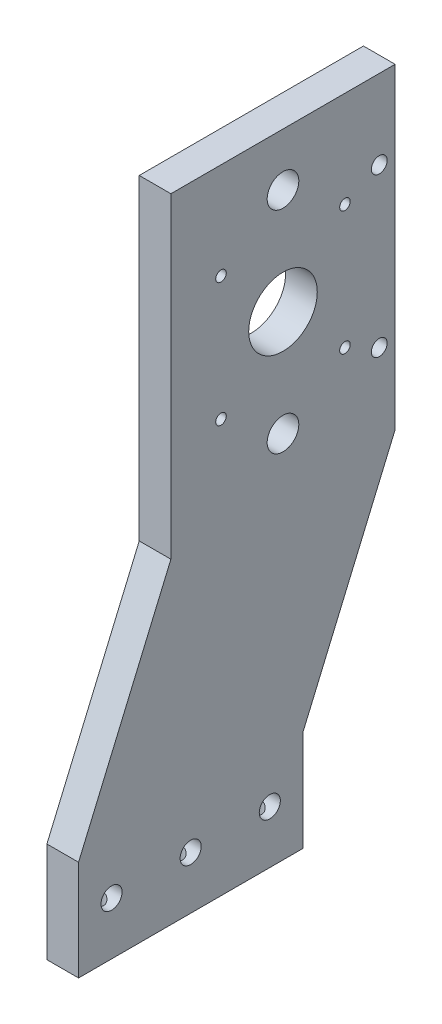
from build123d import *

# Parameters (mm, degrees)
BOSS_EXTRUDE1_DEPTH = 12
CUT_EXTRUDE1_REACH  = 270.596
SKETCH2_R           = 4
CUT_EXTRUDE2_REACH  = 270.596
SKETCH3_R           = 3
CUT_EXTRUDE3_REACH  = 270.596
SKETCH4_R           = 13
SKETCH4_R_2         = 6
SKETCH4_R_3         = 2
CUT_EXTRUDE4_REACH  = 270.596
SKETCH5_R           = 3


with BuildPart() as part:
    # Sketch1 → Boss-Extrude1 (new body)
    with BuildSketch(Plane(origin=(0, 0, 0), x_dir=(0, 0, -1), z_dir=(1, 0, 0))):
        Polygon((120, 240), (35, 240), (35, 120), (0, 38), (0, 0), (85, 0), (85, 38), (120, 120), align=None)
    extrude(amount=BOSS_EXTRUDE1_DEPTH)

    # Sketch2 → Cut-Extrude1 (cut, up to next)
    with BuildSketch(Plane.ZY, mode=Mode.PRIVATE) as cut_extrude1_sk1:
        with Locations((-42.5, 20)):
            Circle(SKETCH2_R)
    cut_extrude1_tool1 = extrude(cut_extrude1_sk1.sketch, amount=-CUT_EXTRUDE1_REACH, mode=Mode.PRIVATE) & part.part
    # Sketch2 → Cut-Extrude1 (cut, up to next)
    with BuildSketch(Plane.ZY, mode=Mode.PRIVATE) as cut_extrude1_sk2:
        with Locations((-72.5, 20)):
            Circle(SKETCH2_R)
    cut_extrude1_tool2 = extrude(cut_extrude1_sk2.sketch, amount=-CUT_EXTRUDE1_REACH, mode=Mode.PRIVATE) & part.part
    # Sketch2 → Cut-Extrude1 (cut, up to next)
    with BuildSketch(Plane.ZY, mode=Mode.PRIVATE) as cut_extrude1_sk3:
        with Locations((-12.5, 20)):
            Circle(SKETCH2_R)
    cut_extrude1_tool3 = extrude(cut_extrude1_sk3.sketch, amount=-CUT_EXTRUDE1_REACH, mode=Mode.PRIVATE) & part.part
    add(cut_extrude1_tool1.solids().sort_by_distance((0, 20, -42.5))[0], mode=Mode.SUBTRACT)
    add(cut_extrude1_tool2.solids().sort_by_distance((0, 20, -72.5))[0], mode=Mode.SUBTRACT)
    add(cut_extrude1_tool3.solids().sort_by_distance((0, 20, -12.5))[0], mode=Mode.SUBTRACT)

    # Sketch3 → Cut-Extrude2 (cut, up to next)
    with BuildSketch(Plane.XZ, mode=Mode.PRIVATE) as cut_extrude2_sk1:
        with Locations(Location((6, -42.5, 0), (0, 0, 270))):
            Circle(SKETCH3_R)
    cut_extrude2_tool1 = extrude(cut_extrude2_sk1.sketch, amount=-CUT_EXTRUDE2_REACH, mode=Mode.PRIVATE) & part.part
    # Sketch3 → Cut-Extrude2 (cut, up to next)
    with BuildSketch(Plane.XZ, mode=Mode.PRIVATE) as cut_extrude2_sk2:
        with Locations(Location((6, -72.5, 0), (0, 0, 270))):
            Circle(SKETCH3_R)
    cut_extrude2_tool2 = extrude(cut_extrude2_sk2.sketch, amount=-CUT_EXTRUDE2_REACH, mode=Mode.PRIVATE) & part.part
    # Sketch3 → Cut-Extrude2 (cut, up to next)
    with BuildSketch(Plane.XZ, mode=Mode.PRIVATE) as cut_extrude2_sk3:
        with Locations(Location((6, -12.5, 0), (0, 0, 270))):
            Circle(SKETCH3_R)
    cut_extrude2_tool3 = extrude(cut_extrude2_sk3.sketch, amount=-CUT_EXTRUDE2_REACH, mode=Mode.PRIVATE) & part.part
    add(cut_extrude2_tool1.solids().sort_by_distance((6, 0, -42.5))[0], mode=Mode.SUBTRACT)
    add(cut_extrude2_tool2.solids().sort_by_distance((6, 0, -72.5))[0], mode=Mode.SUBTRACT)
    add(cut_extrude2_tool3.solids().sort_by_distance((6, 0, -12.5))[0], mode=Mode.SUBTRACT)

    # Sketch4 → Cut-Extrude3 (cut, up to next)
    with BuildSketch(Plane.ZY, mode=Mode.PRIVATE) as cut_extrude3_sk1:
        with Locations((-77.5, 180)):
            Circle(SKETCH4_R)
    cut_extrude3_tool1 = extrude(cut_extrude3_sk1.sketch, amount=-CUT_EXTRUDE3_REACH, mode=Mode.PRIVATE) & part.part
    # Sketch4 → Cut-Extrude3 (cut, up to next)
    with BuildSketch(Plane.ZY, mode=Mode.PRIVATE) as cut_extrude3_sk2:
        with Locations((-77.5, 220)):
            Circle(SKETCH4_R_2)
    cut_extrude3_tool2 = extrude(cut_extrude3_sk2.sketch, amount=-CUT_EXTRUDE3_REACH, mode=Mode.PRIVATE) & part.part
    # Sketch4 → Cut-Extrude3 (cut, up to next)
    with BuildSketch(Plane.ZY, mode=Mode.PRIVATE) as cut_extrude3_sk3:
        with Locations((-77.5, 140)):
            Circle(SKETCH4_R_2)
    cut_extrude3_tool3 = extrude(cut_extrude3_sk3.sketch, amount=-CUT_EXTRUDE3_REACH, mode=Mode.PRIVATE) & part.part
    # Sketch4 → Cut-Extrude3 (cut, up to next)
    with BuildSketch(Plane.ZY, mode=Mode.PRIVATE) as cut_extrude3_sk4:
        with Locations((-101, 203.5)):
            Circle(SKETCH4_R_3)
    cut_extrude3_tool4 = extrude(cut_extrude3_sk4.sketch, amount=-CUT_EXTRUDE3_REACH, mode=Mode.PRIVATE) & part.part
    # Sketch4 → Cut-Extrude3 (cut, up to next)
    with BuildSketch(Plane.ZY, mode=Mode.PRIVATE) as cut_extrude3_sk5:
        with Locations((-54, 203.5)):
            Circle(SKETCH4_R_3)
    cut_extrude3_tool5 = extrude(cut_extrude3_sk5.sketch, amount=-CUT_EXTRUDE3_REACH, mode=Mode.PRIVATE) & part.part
    # Sketch4 → Cut-Extrude3 (cut, up to next)
    with BuildSketch(Plane.ZY, mode=Mode.PRIVATE) as cut_extrude3_sk6:
        with Locations((-101, 156.5)):
            Circle(SKETCH4_R_3)
    cut_extrude3_tool6 = extrude(cut_extrude3_sk6.sketch, amount=-CUT_EXTRUDE3_REACH, mode=Mode.PRIVATE) & part.part
    # Sketch4 → Cut-Extrude3 (cut, up to next)
    with BuildSketch(Plane.ZY, mode=Mode.PRIVATE) as cut_extrude3_sk7:
        with Locations((-54, 156.5)):
            Circle(SKETCH4_R_3)
    cut_extrude3_tool7 = extrude(cut_extrude3_sk7.sketch, amount=-CUT_EXTRUDE3_REACH, mode=Mode.PRIVATE) & part.part
    add(cut_extrude3_tool1.solids().sort_by_distance((0, 180, -77.5))[0], mode=Mode.SUBTRACT)
    add(cut_extrude3_tool2.solids().sort_by_distance((0, 220, -77.5))[0], mode=Mode.SUBTRACT)
    add(cut_extrude3_tool3.solids().sort_by_distance((0, 140, -77.5))[0], mode=Mode.SUBTRACT)
    add(cut_extrude3_tool4.solids().sort_by_distance((0, 203.5, -101))[0], mode=Mode.SUBTRACT)
    add(cut_extrude3_tool5.solids().sort_by_distance((0, 203.5, -54))[0], mode=Mode.SUBTRACT)
    add(cut_extrude3_tool6.solids().sort_by_distance((0, 156.5, -101))[0], mode=Mode.SUBTRACT)
    add(cut_extrude3_tool7.solids().sort_by_distance((0, 156.5, -54))[0], mode=Mode.SUBTRACT)

    # Sketch5 → Cut-Extrude4 (cut, up to next)
    with BuildSketch(Plane.ZY, mode=Mode.PRIVATE) as cut_extrude4_sk1:
        with Locations((-114, 210)):
            Circle(SKETCH5_R)
    cut_extrude4_tool1 = extrude(cut_extrude4_sk1.sketch, amount=-CUT_EXTRUDE4_REACH, mode=Mode.PRIVATE) & part.part
    # Sketch5 → Cut-Extrude4 (cut, up to next)
    with BuildSketch(Plane.ZY, mode=Mode.PRIVATE) as cut_extrude4_sk2:
        with Locations((-114, 150)):
            Circle(SKETCH5_R)
    cut_extrude4_tool2 = extrude(cut_extrude4_sk2.sketch, amount=-CUT_EXTRUDE4_REACH, mode=Mode.PRIVATE) & part.part
    add(cut_extrude4_tool1.solids().sort_by_distance((0, 210, -114))[0], mode=Mode.SUBTRACT)
    add(cut_extrude4_tool2.solids().sort_by_distance((0, 150, -114))[0], mode=Mode.SUBTRACT)


solid = part.part
